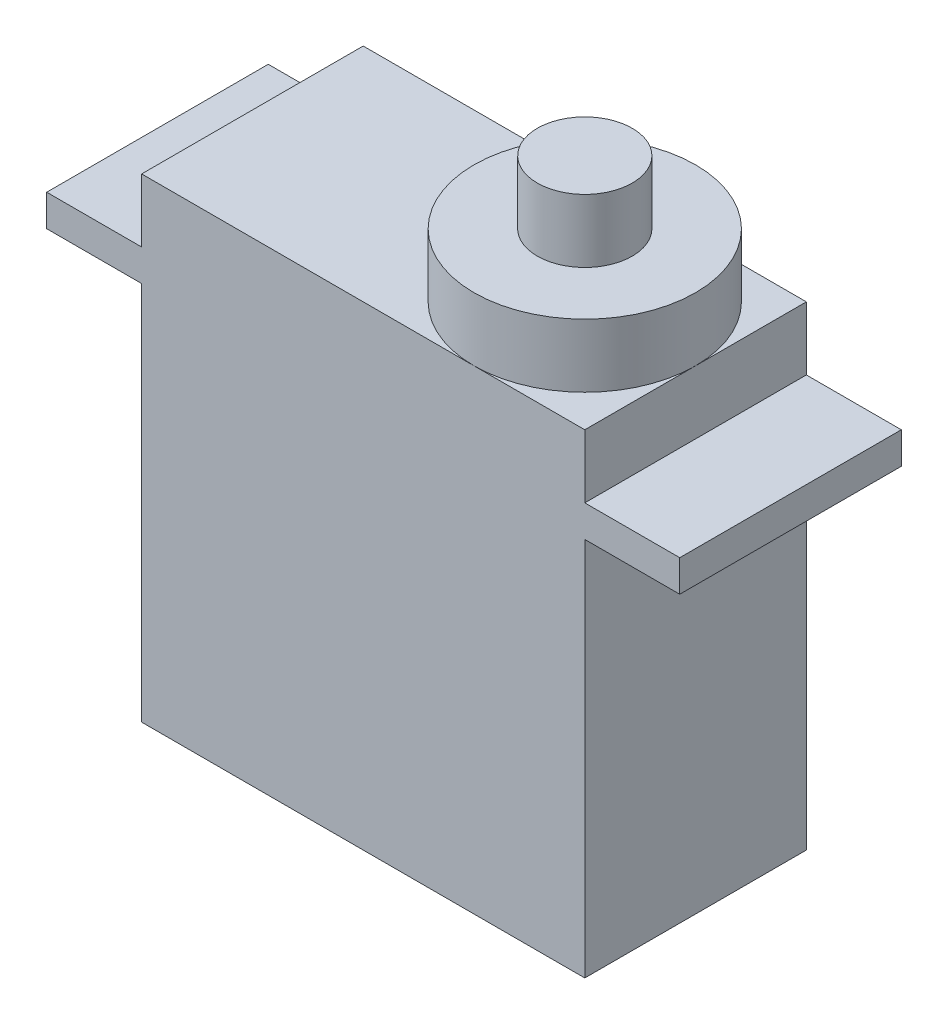
from build123d import *

# Parameters (mm, degrees)
SKETCH1_W           = 22.225
SKETCH1_H           = 11.1125
BOSS_EXTRUDE1_DEPTH = 23.8125
SKETCH2_W           = 11.1125
SKETCH2_H           = 1.5875
BOSS_EXTRUDE2_DEPTH = 4.7625
SKETCH3_R           = 5.55625
BOSS_EXTRUDE3_DEPTH = 3.175
SKETCH4_R           = 2.38125
BOSS_EXTRUDE4_DEPTH = 3.175


with BuildPart() as part:
    # Sketch1 → Boss-Extrude1 (new body)
    with BuildSketch(Plane(origin=(0, 0, 0), x_dir=(1, 0, 0), z_dir=(0, 1, 0))):
        Rectangle(SKETCH1_W, SKETCH1_H)
    extrude(amount=BOSS_EXTRUDE1_DEPTH)

    # Sketch2 → Boss-Extrude2 (add)
    with BuildSketch(Plane(origin=(11.1125, 0, 0), x_dir=(0, 0, -1), z_dir=(1, 0, 0))):
        with Locations((0, 19.84375)):
            Rectangle(SKETCH2_W, SKETCH2_H)
    boss_extrude2 = extrude(amount=BOSS_EXTRUDE2_DEPTH)

    # Mirror2: Boss-Extrude2 across plane
    add(boss_extrude2.mirror(Plane.ZY))

    # Sketch3 → Boss-Extrude3 (add)
    with BuildSketch(Plane(origin=(0, 23.8125, 0), x_dir=(1, 0, 0), z_dir=(0, 1, 0))):
        with Locations(Location((5.55625, 0, 0), (0, 0, 270))):
            Circle(SKETCH3_R)
    extrude(amount=BOSS_EXTRUDE3_DEPTH)

    # Sketch4 → Boss-Extrude4 (add)
    with BuildSketch(Plane(origin=(0, 26.9875, 0), x_dir=(1, 0, 0), z_dir=(0, 1, 0))):
        with Locations(Location((5.55625, 0, 0), (0, 0, 270))):
            Circle(SKETCH4_R)
    extrude(amount=BOSS_EXTRUDE4_DEPTH)


solid = part.part
